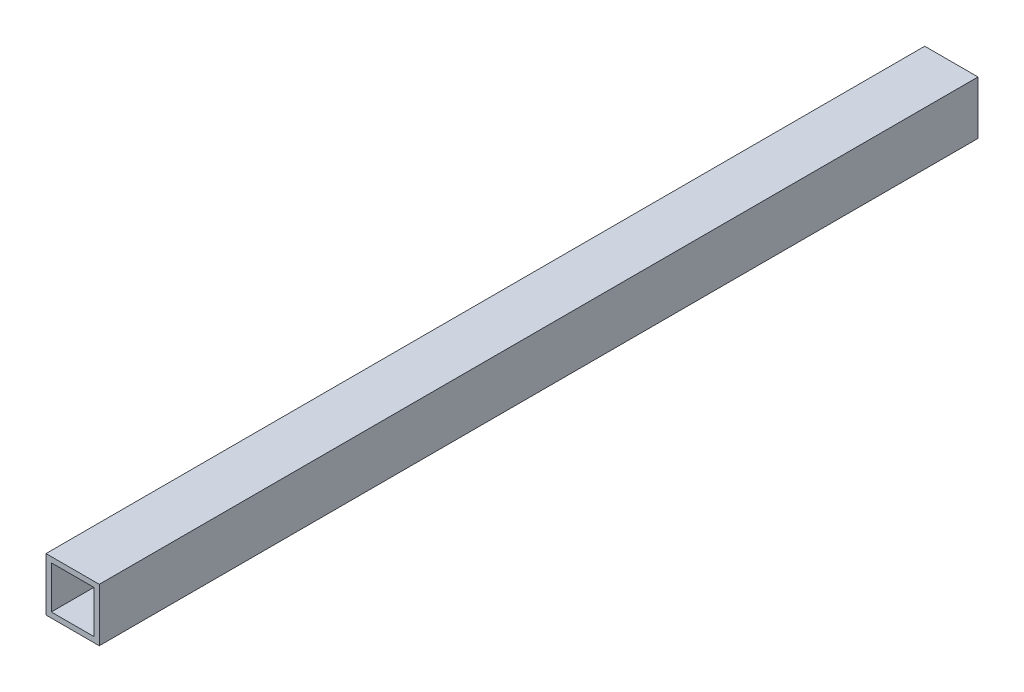
from build123d import *

# Parameters (mm, degrees)
SKETCH1_W           = 25.4
SKETCH1_H           = 25.4
SKETCH1_W_2         = 20.32
SKETCH1_H_2         = 20.32
BOSS_EXTRUDE1_DEPTH = 209.55


with BuildPart() as part:
    # Sketch1 → Boss-Extrude1 (new, symmetric)
    with BuildSketch(Plane.XY):
        Rectangle(SKETCH1_W, SKETCH1_H)
        Rectangle(SKETCH1_W_2, SKETCH1_H_2, mode=Mode.SUBTRACT)
    extrude(amount=BOSS_EXTRUDE1_DEPTH, both=True)


solid = part.part
